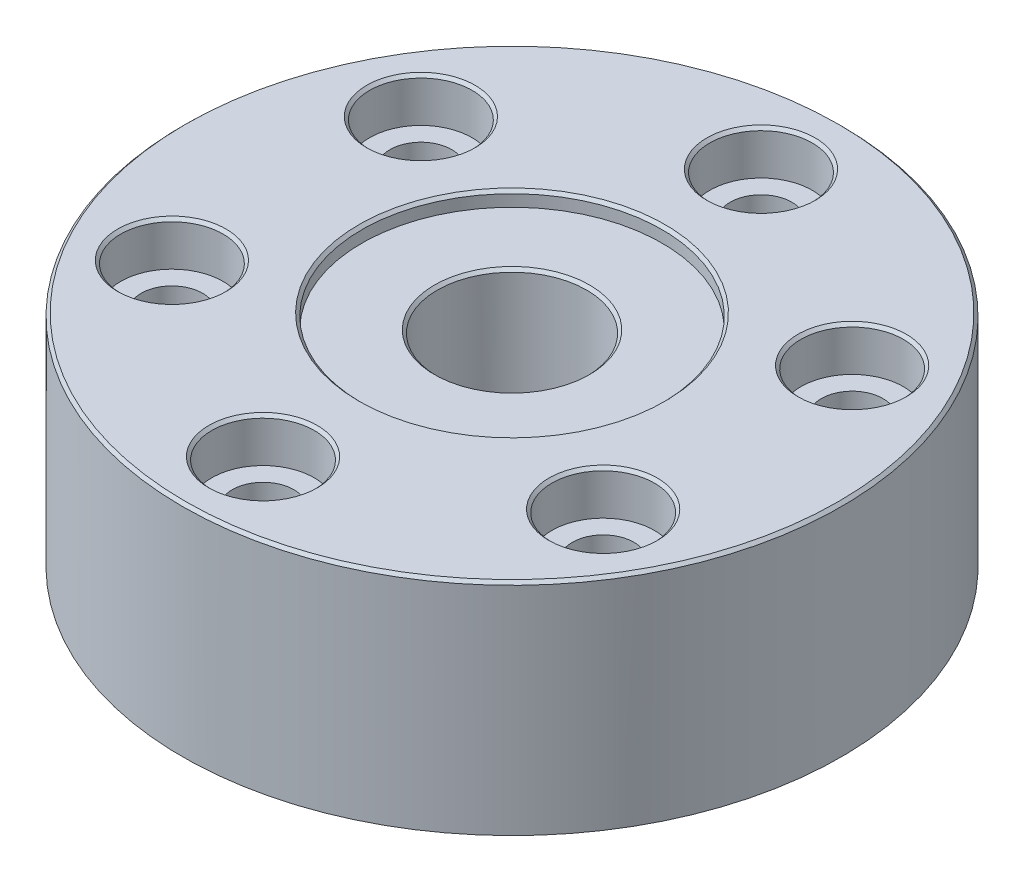
from build123d import *

# Parameters (mm, degrees)
SKETCH_1_W                     = 22.5
SKETCH_1_H                     = 15
HOLE_WIZARD_M3_5_1_D           = 4.2
HOLE_WIZARD_M3_5_1_CBORE_D     = 7
HOLE_WIZARD_M3_5_1_CBORE_DEPTH = 3
HOLE_WIZARD_1_D                = 10.2
HOLE_WIZARD_1_CBORE_D          = 20.5
HOLE_WIZARD_1_CBORE_DEPTH      = 1
CHAMFER_1_SIZE                 = 0.2


with BuildPart() as part:
    # 草图1 → 旋转1 (revolve)
    with BuildSketch(Plane.XY, mode=Mode.PRIVATE) as revolve_1_sk:
        with Locations((11.25, 7.5)):
            Rectangle(SKETCH_1_W, SKETCH_1_H)
    revolve(revolve_1_sk.sketch.rotate(Axis((0, 15, 0), (0, -1, 0)), 270), axis=Axis((0, 15, 0), (0, -1, 0)))

    # M3.5 六角头机械螺钉的柱形沉头孔1 (through all)
    with Locations(Plane(origin=(0, 15, 0), x_dir=(1, 0, 0), z_dir=(0, 1, 0))):
        with Locations((14.722431864, 8.5), (14.722431864, -8.5), (0, -17), (-14.722431864, -8.5), (-14.722431864, 8.5), (0, 17)):
            CounterBoreHole(HOLE_WIZARD_M3_5_1_D / 2, HOLE_WIZARD_M3_5_1_CBORE_D / 2, HOLE_WIZARD_M3_5_1_CBORE_DEPTH)

    # 孔1 (through all)
    with Locations(Plane(origin=(0, 15, 0), x_dir=(1, 0, 0), z_dir=(0, 1, 0))):
        with Locations((0, 0)):
            CounterBoreHole(HOLE_WIZARD_1_D / 2, HOLE_WIZARD_1_CBORE_D / 2, HOLE_WIZARD_1_CBORE_DEPTH)

    # 倒角1
    chamfer_1_edges = [part.edges().sort_by_distance(p)[0] for p in [
        (-3.5, 15, -17),
        (-18.222431864, 15, -8.5),
        (-18.222431864, 15, 8.5),
        (-3.5, 15, 17),
        (11.222431864, 15, 8.5),
        (11.222431864, 15, -8.5),
        (0, 15, 22.5),
        (-10.25, 15, 0),
        (5.1, 14, 0),
    ]]
    chamfer(chamfer_1_edges, length=CHAMFER_1_SIZE)


solid = part.part
